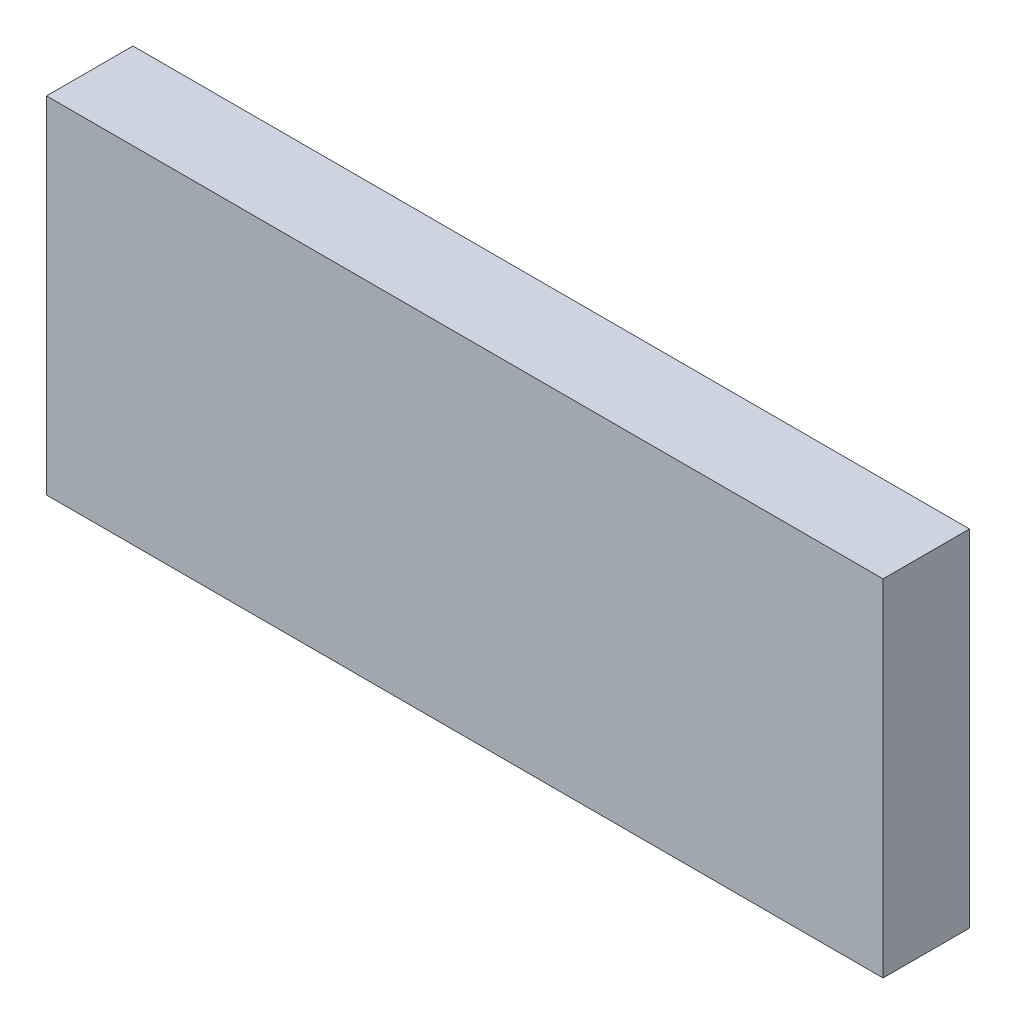
from build123d import *

# Parameters (mm, degrees)
CROQUIS1_W              = 96.804931296
CROQUIS1_H              = 40
SALIENTE_EXTRUIR1_DEPTH = 10


with BuildPart() as part:
    # Croquis1 → Saliente-Extruir1 (new body)
    with BuildSketch(Plane.XY):
        Rectangle(CROQUIS1_W, CROQUIS1_H)
    extrude(amount=SALIENTE_EXTRUIR1_DEPTH)


solid = part.part
